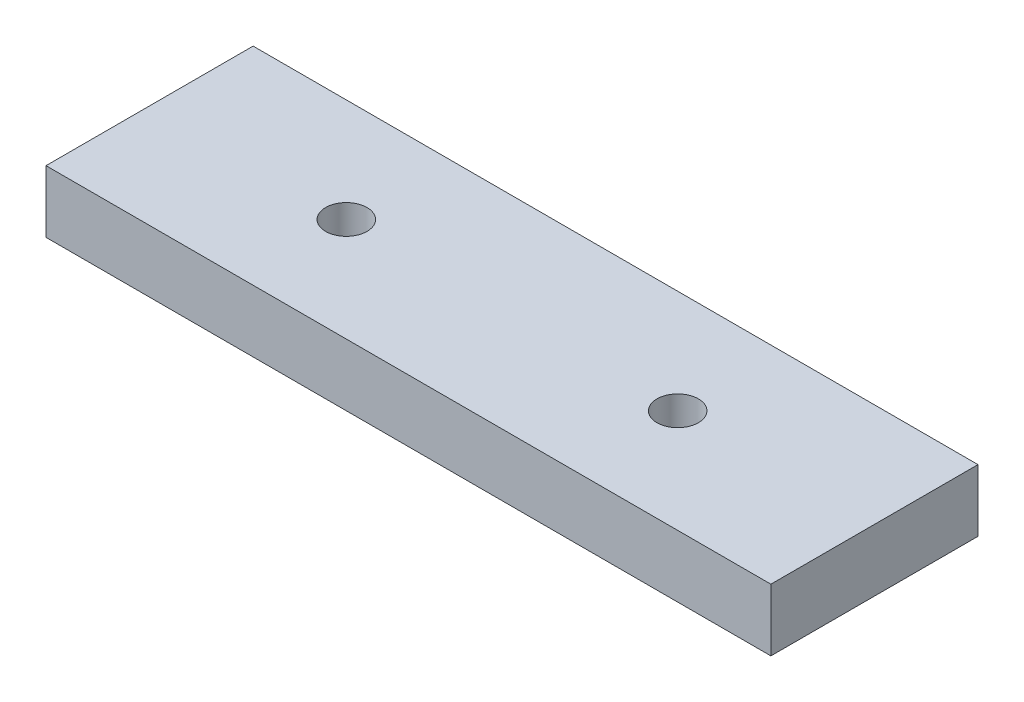
from build123d import *

# Parameters (mm, degrees)
SKETCH1_W           = 35
SKETCH1_H           = 10
BOSS_EXTRUDE1_DEPTH = 1.5
SKETCH2_R           = 1
CUT_EXTRUDE1_DEPTH  = 19.445866746


with BuildPart() as part:
    # Sketch1 → Boss-Extrude1 (new, symmetric)
    with BuildSketch(Plane(origin=(0, 0, 0), x_dir=(1, 0, 0), z_dir=(0, 1, 0))):
        Rectangle(SKETCH1_W, SKETCH1_H)
    extrude(amount=BOSS_EXTRUDE1_DEPTH, both=True)

    # Sketch2 → Cut-Extrude1 (cut, through all)
    with BuildSketch(Plane(origin=(0, 1.5, 0), x_dir=(1, 0, 0), z_dir=(0, 1, 0))):
        with Locations(Location((-8, 0, 0), (0, 0, 270))):
            Circle(SKETCH2_R)
        with Locations(Location((8, 0, 0), (0, 0, 270))):
            Circle(SKETCH2_R)
    extrude(amount=-CUT_EXTRUDE1_DEPTH, mode=Mode.SUBTRACT)


solid = part.part
